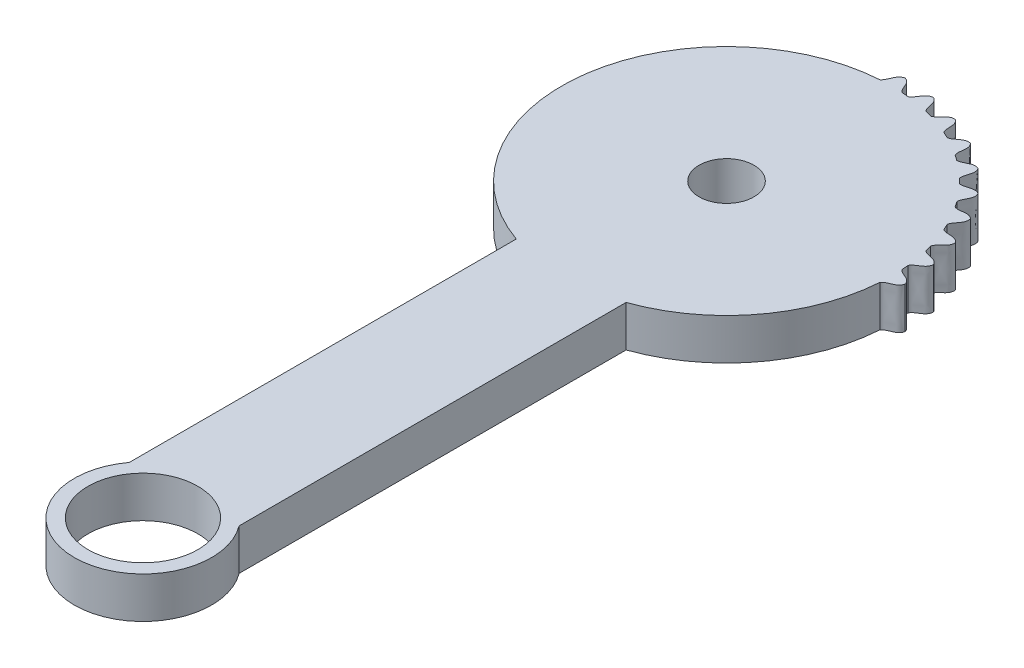
from build123d import *

# Parameters (mm, degrees)
SKETCH_1_R      = 2
EXTRUDE_1_DEPTH = 3
EXTRUDE_START   = -3
EXTRUDE_2_DEPTH = 3


with BuildPart() as part:
    # 草图1 → 凸台-拉伸1 (new body)
    with BuildSketch(Plane(origin=(0, 0, 0), x_dir=(1, 0, 0), z_dir=(0, 1, 0))):
        with BuildLine():
            ThreePointArc((-0.804164412, 11.973024664), (-8.485281374, -8.485281374), (11.973024664, -0.804164412))
            add(Edge.make_bspline(
                [(13, 0), (12.923284361, -0.311828909), (12.495573917, -0.491752354), (12.082770065, -0.660295948), (11.973024664, -0.804164412)],
                knots=[0, 0, 0, 0, 0.61500276, 1, 1, 1, 1], degree=3))
            add(Edge.make_bspline(
                [(13, 0), (12.923284361, 0.311828909), (12.495573917, 0.491752354), (12.082770065, 0.660295948), (11.973024664, 0.804164412)],
                knots=[0, 0, 0, 0, 0.61500276, 1, 1, 1, 1], degree=3))
            ThreePointArc((11.973024664, 0.804164412), (11.954336377, 1.045868913), (11.930769201, 1.287146566))
            add(Edge.make_bspline(
                [(12.802500789, 2.25742631), (12.781099155, 1.937013252), (12.391129972, 1.685552109), (12.013864826, 1.447886434), (11.930769201, 1.287146566)],
                knots=[0, 0, 0, 0, 0.61500276, 1, 1, 1, 1], degree=3))
            add(Edge.make_bspline(
                [(12.802500789, 2.25742631), (12.672802111, 2.551196306), (12.220346171, 2.65411517), (11.78454645, 2.748415572), (11.651485831, 2.871041262)],
                knots=[0, 0, 0, 0, 0.61500276, 1, 1, 1, 1], degree=3))
            ThreePointArc((11.651485831, 2.871041262), (11.591109915, 3.105828541), (11.526003353, 3.339348247))
            add(Edge.make_bspline(
                [(12.21600407, 4.446261863), (12.250566718, 4.127000245), (11.910187813, 3.811641924), (11.579924383, 3.51207552), (11.526003353, 3.339348247)],
                knots=[0, 0, 0, 0, 0.61500276, 1, 1, 1, 1], degree=3))
            add(Edge.make_bspline(
                [(12.21600407, 4.446261863), (12.037263182, 4.713046894), (11.573809391, 4.73583404), (11.128255354, 4.753025979), (10.975922497, 4.850682976)],
                knots=[0, 0, 0, 0, 0.61500276, 1, 1, 1, 1], degree=3))
            ThreePointArc((10.975922497, 4.850682976), (10.875693444, 5.071419141), (10.771025725, 5.290085522))
            add(Edge.make_bspline(
                [(11.258330249, 6.5), (11.347807011, 6.191590424), (11.067360624, 5.821916927), (10.794133798, 5.469551968), (10.771025725, 5.290085522)],
                knots=[0, 0, 0, 0, 0.61500276, 1, 1, 1, 1], degree=3))
            add(Edge.make_bspline(
                [(11.258330249, 6.5), (11.035978102, 6.731693937), (10.57560827, 6.673656989), (10.13383785, 6.613218097), (9.966861313, 6.682939142)],
                knots=[0, 0, 0, 0, 0.61500276, 1, 1, 1, 1], degree=3))
            ThreePointArc((9.966861313, 6.682939142), (9.829824531, 6.882917236), (9.688775931, 7.080086225))
            add(Edge.make_bspline(
                [(9.958577761, 8.356238926), (10.10024993, 8.068052261), (9.888257283, 7.655295931), (9.68036892, 7.260838847), (9.688775931, 7.080086225)],
                knots=[0, 0, 0, 0, 0.61500276, 1, 1, 1, 1], degree=3))
            add(Edge.make_bspline(
                [(9.958577761, 8.356238926), (9.699370412, 8.545801866), (9.256072642, 8.408704248), (8.831508812, 8.27247093), (8.654962091, 8.312137584)],
                knots=[0, 0, 0, 0, 0.61500276, 1, 1, 1, 1], degree=3))
            ThreePointArc((8.654962091, 8.312137584), (8.485281374, 8.485281374), (8.312137584, 8.654962091))
            add(Edge.make_bspline(
                [(8.356238926, 9.958577761), (8.545801866, 9.699370412), (8.408704248, 9.256072642), (8.27247093, 8.831508812), (8.312137584, 8.654962091)],
                knots=[0, 0, 0, 0, 0.61500276, 1, 1, 1, 1], degree=3))
            add(Edge.make_bspline(
                [(8.356238926, 9.958577761), (8.068052261, 10.10024993), (7.655295931, 9.888257283), (7.260838847, 9.68036892), (7.080086225, 9.688775931)],
                knots=[0, 0, 0, 0, 0.61500276, 1, 1, 1, 1], degree=3))
            ThreePointArc((7.080086225, 9.688775931), (6.882917236, 9.829824531), (6.682939142, 9.966861313))
            add(Edge.make_bspline(
                [(6.5, 11.258330249), (6.731693937, 11.035978102), (6.673656989, 10.57560827), (6.613218097, 10.13383785), (6.682939142, 9.966861313)],
                knots=[0, 0, 0, 0, 0.61500276, 1, 1, 1, 1], degree=3))
            add(Edge.make_bspline(
                [(6.5, 11.258330249), (6.191590424, 11.347807011), (5.821916927, 11.067360624), (5.469551968, 10.794133798), (5.290085522, 10.771025725)],
                knots=[0, 0, 0, 0, 0.61500276, 1, 1, 1, 1], degree=3))
            ThreePointArc((5.290085522, 10.771025725), (5.071419141, 10.875693444), (4.850682976, 10.975922497))
            add(Edge.make_bspline(
                [(4.446261863, 12.21600407), (4.713046894, 12.037263182), (4.73583404, 11.573809391), (4.753025979, 11.128255354), (4.850682976, 10.975922497)],
                knots=[0, 0, 0, 0, 0.61500276, 1, 1, 1, 1], degree=3))
            add(Edge.make_bspline(
                [(4.446261863, 12.21600407), (4.127000245, 12.250566718), (3.811641924, 11.910187813), (3.51207552, 11.579924383), (3.339348247, 11.526003353)],
                knots=[0, 0, 0, 0, 0.61500276, 1, 1, 1, 1], degree=3))
            ThreePointArc((3.339348247, 11.526003353), (3.105828541, 11.591109915), (2.871041262, 11.651485831))
            add(Edge.make_bspline(
                [(2.25742631, 12.802500789), (2.551196306, 12.672802111), (2.65411517, 12.220346171), (2.748415572, 11.78454645), (2.871041262, 11.651485831)],
                knots=[0, 0, 0, 0, 0.61500276, 1, 1, 1, 1], degree=3))
            add(Edge.make_bspline(
                [(2.25742631, 12.802500789), (1.937013252, 12.781099155), (1.685552109, 12.391129972), (1.447886434, 12.013864826), (1.287146566, 11.930769201)],
                knots=[0, 0, 0, 0, 0.61500276, 1, 1, 1, 1], degree=3))
            ThreePointArc((1.287146566, 11.930769201), (1.045868913, 11.954336377), (0.804164412, 11.973024664))
            add(Edge.make_bspline(
                [(0, 13), (0.311828909, 12.923284361), (0.491752354, 12.495573917), (0.660295948, 12.082770065), (0.804164412, 11.973024664)],
                knots=[0, 0, 0, 0, 0.61500276, 1, 1, 1, 1], degree=3))
            add(Edge.make_bspline(
                [(0, 13), (-0.311828909, 12.923284361), (-0.491752354, 12.495573917), (-0.660295948, 12.082770065), (-0.804164412, 11.973024664)],
                knots=[0, 0, 0, 0, 0.61500276, 1, 1, 1, 1], degree=3))
        make_face()
        with Locations(Location((0, 0, 0), (0, 0, 270))):
            Circle(SKETCH_1_R, mode=Mode.SUBTRACT)
    extrude(amount=EXTRUDE_1_DEPTH)

    # 草图2 → 凸台-拉伸2 (add)
    with BuildSketch(Plane(origin=(0, 3, 0), x_dir=(1, 0, 0), z_dir=(0, 1, 0)).offset(EXTRUDE_START)):
        with BuildLine():
            ThreePointArc((4, -11.313708499), (2.029223745, -11.827182716), (0, -12))
            Line((0, -12), (0, -37.5))
            ThreePointArc((0, -37.5), (2.236067977, -38.027864045), (4, -39.5))
            Line((4, -39.5), (4, -11.313708499))
        make_face()
        with BuildLine():
            Line((0, -37.5), (0, -12))
            ThreePointArc((0, -12), (-2.029223745, -11.827182716), (-4, -11.313708499))
            Line((-4, -11.313708499), (-4, -39.5))
            ThreePointArc((-4, -39.5), (-2.236067977, -38.027864045), (0, -37.5))
        make_face()
        with BuildLine():
            ThreePointArc((4, -39.5), (2.236067977, -38.027864045), (0, -37.5))
            Line((0, -37.5), (0, -38.5))
            ThreePointArc((0, -38.5), (1.414213562, -38.758342613), (2.645751311, -39.5))
            Line((2.645751311, -39.5), (4, -39.5))
        make_face()
        with BuildLine():
            Line((0, -38.5), (0, -37.5))
            ThreePointArc((0, -37.5), (-2.236067977, -38.027864045), (-4, -39.5))
            Line((-4, -39.5), (-2.645751311, -39.5))
            ThreePointArc((-2.645751311, -39.5), (-1.414213562, -38.758342613), (0, -38.5))
        make_face()
        with BuildLine():
            ThreePointArc((5, -42.5), (4.74341649, -40.91886117), (4, -39.5))
            Line((4, -39.5), (2.645751311, -39.5))
            ThreePointArc((2.645751311, -39.5), (3.645751311, -40.854248689), (4, -42.5))
            ThreePointArc((4, -42.5), (2.828427125, -45.328427125), (0, -46.5))
            Line((0, -46.5), (0, -47.5))
            ThreePointArc((0, -47.5), (3.535533906, -46.035533906), (5, -42.5))
        make_face()
        with BuildLine():
            Line((-2.645751311, -39.5), (-4, -39.5))
            ThreePointArc((-4, -39.5), (-4.472135955, -44.736067977), (0, -47.5))
            Line((0, -47.5), (0, -46.5))
            ThreePointArc((0, -46.5), (-3.741657387, -43.914213562), (-2.645751311, -39.5))
        make_face()
    extrude(amount=EXTRUDE_2_DEPTH)


solid = part.part
